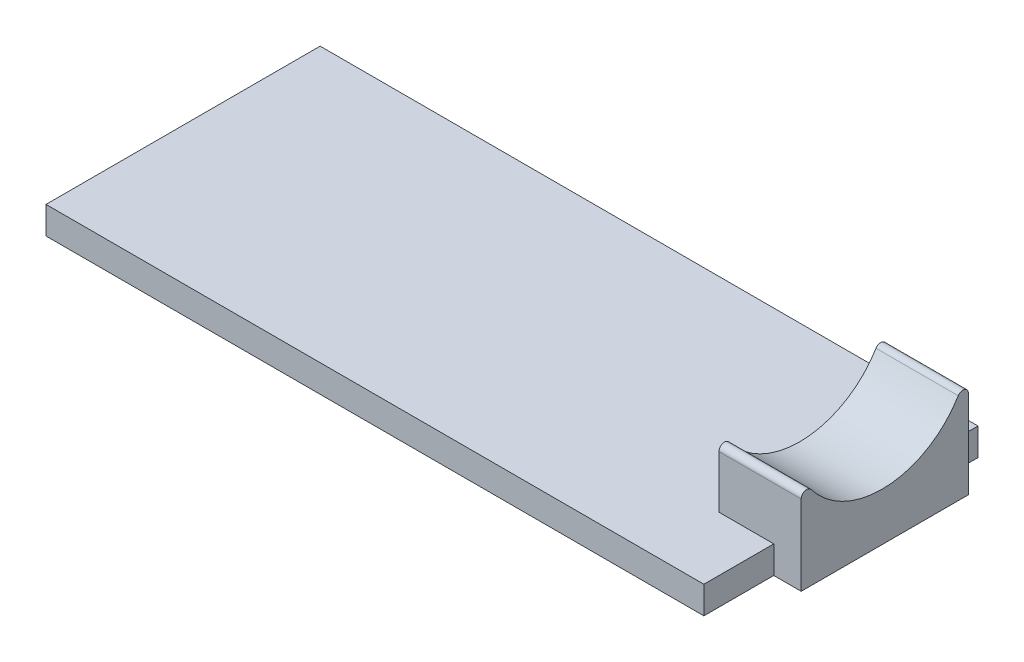
from build123d import *

# Parameters (mm, degrees)
SKETCH1_W           = 24
SKETCH1_H           = 10
BOSS_EXTRUDE1_DEPTH = 1
SKETCH2_W           = 3
SKETCH2_H           = 6.1
BOSS_EXTRUDE2_DEPTH = 3.25
SKETCH3_R           = 3.25
CUT_EXTRUDE1_DEPTH  = 3
FILLET1_R           = 0.2
SKETCH4_W           = 1
SKETCH4_H           = 6.1
BOSS_EXTRUDE3_DEPTH = 1


with BuildPart() as part:
    # Sketch1 → Boss-Extrude1 (new body)
    with BuildSketch(Plane(origin=(0, 0, 0), x_dir=(1, 0, 0), z_dir=(0, 1, 0))):
        with Locations((-12, 5)):
            Rectangle(SKETCH1_W, SKETCH1_H)
    extrude(amount=BOSS_EXTRUDE1_DEPTH)

    # Sketch2 → Boss-Extrude2 (add)
    with BuildSketch(Plane(origin=(0, 1, 0), x_dir=(1, 0, 0), z_dir=(0, 1, 0))):
        with Locations((-0.5, 5.6)):
            Rectangle(SKETCH2_W, SKETCH2_H)
    extrude(amount=BOSS_EXTRUDE2_DEPTH)

    # Sketch3 → Cut-Extrude1 (cut)
    with BuildSketch(Plane(origin=(-2, 0, 0), x_dir=(0, 0, -1), z_dir=(1, 0, 0))):
        with Locations((5.5, 5)):
            Circle(SKETCH3_R)
    extrude(amount=CUT_EXTRUDE1_DEPTH, mode=Mode.SUBTRACT)

    # Fillet1
    fillet1_edges = [part.edges().sort_by_distance(p)[0] for p in [
        (-0.5, 3.63618183, -2.55),
        (-0.5, 4.2, -8.65),
    ]]
    fillet(fillet1_edges, radius=FILLET1_R)

    # Sketch4 → Boss-Extrude3 (add)
    with BuildSketch(Plane.XZ.offset(-1)):
        with Locations((0.5, -5.6)):
            Rectangle(SKETCH4_W, SKETCH4_H)
    extrude(amount=BOSS_EXTRUDE3_DEPTH)


solid = part.part
